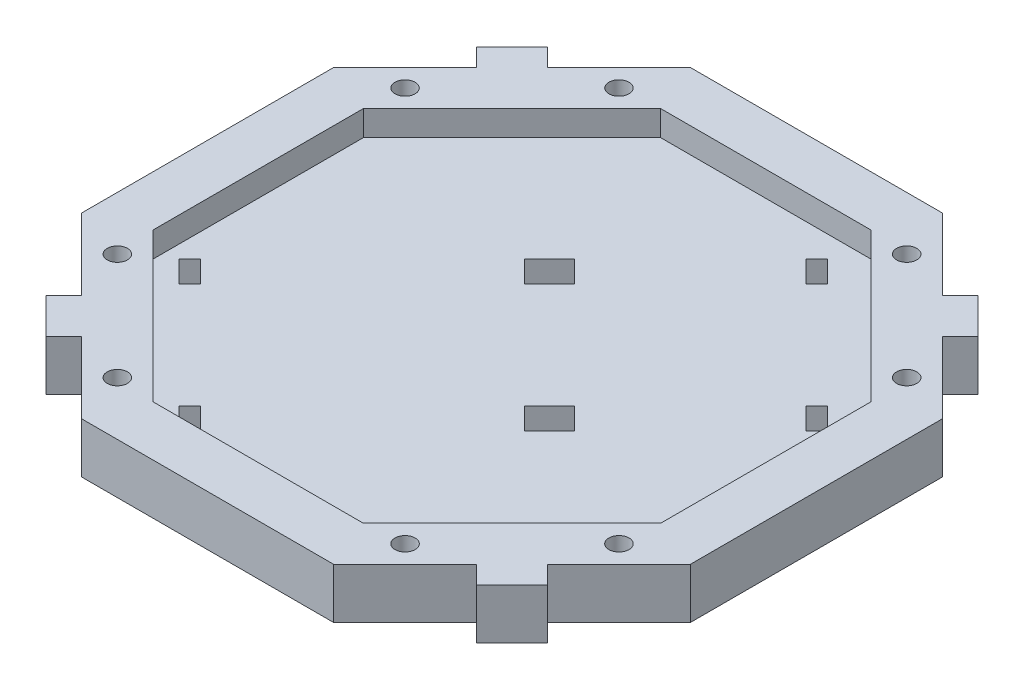
from build123d import *

# Parameters (mm, degrees)
BOSS_EXTRU_2_DEPTH                                   = 10
CHAMBRAGE_POUR_T_TE_CYLINDRIQUE_FENDUE_M_D           = 4
CHAMBRAGE_POUR_T_TE_CYLINDRIQUE_FENDUE_M_CBORE_D     = 5.5
CHAMBRAGE_POUR_T_TE_CYLINDRIQUE_FENDUE_M_CBORE_DEPTH = 4
ENL_V_MAT_EXTRU_1_DEPTH                              = 5
ENL_V_MAT_EXTRU_2_REACH                              = 87.502


with BuildPart() as part:
    # Esquisse1 → Boss.-Extru.2 (new body)
    with BuildSketch(Plane(origin=(0, 0, 0), x_dir=(1, 0, 0), z_dir=(0, 1, 0))):
        Polygon((60.355339059, 25), (25, 60.355339059), (-25, 60.355339059), (-60.355339059, 25), (-60.355339059, -25), (-25, -60.355339059), (25, -60.355339059), (60.355339059, -25), align=None)
        Polygon((39.142135624, 46.213203436), (46.213203436, 39.142135624), (49.748737342, 42.67766953), (42.67766953, 49.748737342), align=None)
        Polygon((49.748737342, -42.67766953), (46.213203436, -39.142135624), (39.142135624, -46.213203436), (42.67766953, -49.748737342), align=None)
        Polygon((-42.67766953, -49.748737342), (-39.142135624, -46.213203436), (-46.213203436, -39.142135624), (-49.748737342, -42.67766953), align=None)
        Polygon((-46.213203436, 39.142135624), (-39.142135624, 46.213203436), (-42.67766953, 49.748737342), (-49.748737342, 42.67766953), align=None)
    extrude(amount=BOSS_EXTRU_2_DEPTH)

    # Chambrage pour tête cylindrique fendue M31 (through all)
    with Locations(Plane(origin=(-49.748737342, 0, -28.535533906), x_dir=(0, 0, -1), z_dir=(0, -1, 0))):
        with Locations((0, 0), (21.213203436, 21.213203436), (21.213203436, 78.284271248), (0, 99.497474684), (-78.284271248, 78.284271248), (-57.071067812, 99.497474684), (-78.284271248, 21.213203436), (-57.071067812, 0)):
            CounterBoreHole(CHAMBRAGE_POUR_T_TE_CYLINDRIQUE_FENDUE_M_D / 2, CHAMBRAGE_POUR_T_TE_CYLINDRIQUE_FENDUE_M_CBORE_D / 2, CHAMBRAGE_POUR_T_TE_CYLINDRIQUE_FENDUE_M_CBORE_DEPTH)

    # Esquisse6 → Enlèv. mat.-Extru.1 (cut)
    with BuildSketch(Plane(origin=(0, 10, 0), x_dir=(1, 0, 0), z_dir=(0, 1, 0))):
        Polygon((20.857864376, 50.355339059), (-20.857864376, 50.355339059), (-50.355339059, 20.857864376), (-50.355339059, -20.857864376), (-20.857864376, -50.355339059), (20.857864376, -50.355339059), (50.355339059, -20.857864376), (50.355339059, 20.857864376), align=None)
    extrude(amount=-ENL_V_MAT_EXTRU_1_DEPTH, mode=Mode.SUBTRACT)

    # Esquisse7 → Enlèv. mat.-Extru.2 (cut, up to next)
    with BuildSketch(Plane(origin=(0, 5, 0), x_dir=(1, 0, 0), z_dir=(0, 1, 0)), mode=Mode.PRIVATE) as enl_v_mat_extru_2_sk1:
        Polygon((-47.779960262, -18.282485579), (-45.658639918, -16.161165235), (-41.415999231, -20.403805922), (-43.537319575, -22.525126266), align=None)
    enl_v_mat_extru_2_tool1 = extrude(enl_v_mat_extru_2_sk1.sketch, amount=-ENL_V_MAT_EXTRU_2_REACH, mode=Mode.PRIVATE) & part.part
    # Esquisse7 → Enlèv. mat.-Extru.2 (cut, up to next)
    with BuildSketch(Plane(origin=(0, 5, 0), x_dir=(1, 0, 0), z_dir=(0, 1, 0)), mode=Mode.PRIVATE) as enl_v_mat_extru_2_sk2:
        Polygon((-13.485281374, 16.012193309), (-8.535533906, 20.961940777), (-4.292893219, 16.71930009), (-9.242640687, 11.769552622), align=None)
    enl_v_mat_extru_2_tool2 = extrude(enl_v_mat_extru_2_sk2.sketch, amount=-ENL_V_MAT_EXTRU_2_REACH, mode=Mode.PRIVATE) & part.part
    # Esquisse7 → Enlèv. mat.-Extru.2 (cut, up to next)
    with BuildSketch(Plane(origin=(0, 5, 0), x_dir=(1, 0, 0), z_dir=(0, 1, 0)), mode=Mode.PRIVATE) as enl_v_mat_extru_2_sk3:
        Polygon((14.393398282, 43.890872965), (16.514718626, 46.012193309), (20.757359313, 41.769552622), (18.636038969, 39.648232278), align=None)
    enl_v_mat_extru_2_tool3 = extrude(enl_v_mat_extru_2_sk3.sketch, amount=-ENL_V_MAT_EXTRU_2_REACH, mode=Mode.PRIVATE) & part.part
    # Esquisse7 → Enlèv. mat.-Extru.2 (cut, up to next)
    with BuildSketch(Plane(origin=(0, 5, 0), x_dir=(1, 0, 0), z_dir=(0, 1, 0)), mode=Mode.PRIVATE) as enl_v_mat_extru_2_sk4:
        Polygon((-20.403805922, -41.415999231), (-22.525126266, -43.537319575), (-18.282485579, -47.779960262), (-16.161165235, -45.658639918), align=None)
    enl_v_mat_extru_2_tool4 = extrude(enl_v_mat_extru_2_sk4.sketch, amount=-ENL_V_MAT_EXTRU_2_REACH, mode=Mode.PRIVATE) & part.part
    # Esquisse7 → Enlèv. mat.-Extru.2 (cut, up to next)
    with BuildSketch(Plane(origin=(0, 5, 0), x_dir=(1, 0, 0), z_dir=(0, 1, 0)), mode=Mode.PRIVATE) as enl_v_mat_extru_2_sk5:
        Polygon((39.648232278, 18.636038969), (43.890872965, 14.393398282), (46.012193309, 16.514718626), (41.769552622, 20.757359313), align=None)
    enl_v_mat_extru_2_tool5 = extrude(enl_v_mat_extru_2_sk5.sketch, amount=-ENL_V_MAT_EXTRU_2_REACH, mode=Mode.PRIVATE) & part.part
    # Esquisse7 → Enlèv. mat.-Extru.2 (cut, up to next)
    with BuildSketch(Plane(origin=(0, 5, 0), x_dir=(1, 0, 0), z_dir=(0, 1, 0)), mode=Mode.PRIVATE) as enl_v_mat_extru_2_sk6:
        Polygon((16.71930009, -4.292893219), (11.769552622, -9.242640687), (16.012193309, -13.485281374), (20.961940777, -8.535533906), align=None)
    enl_v_mat_extru_2_tool6 = extrude(enl_v_mat_extru_2_sk6.sketch, amount=-ENL_V_MAT_EXTRU_2_REACH, mode=Mode.PRIVATE) & part.part
    add(enl_v_mat_extru_2_tool1.solids().sort_by_distance((-44.59798, 5, 19.343146))[0], mode=Mode.SUBTRACT)
    add(enl_v_mat_extru_2_tool2.solids().sort_by_distance((-8.889087, 5, -16.365747))[0], mode=Mode.SUBTRACT)
    add(enl_v_mat_extru_2_tool3.solids().sort_by_distance((17.575379, 5, -42.830213))[0], mode=Mode.SUBTRACT)
    add(enl_v_mat_extru_2_tool4.solids().sort_by_distance((-19.343146, 5, 44.59798))[0], mode=Mode.SUBTRACT)
    add(enl_v_mat_extru_2_tool5.solids().sort_by_distance((42.830213, 5, -17.575379))[0], mode=Mode.SUBTRACT)
    add(enl_v_mat_extru_2_tool6.solids().sort_by_distance((16.365747, 5, 8.889087))[0], mode=Mode.SUBTRACT)


solid = part.part
